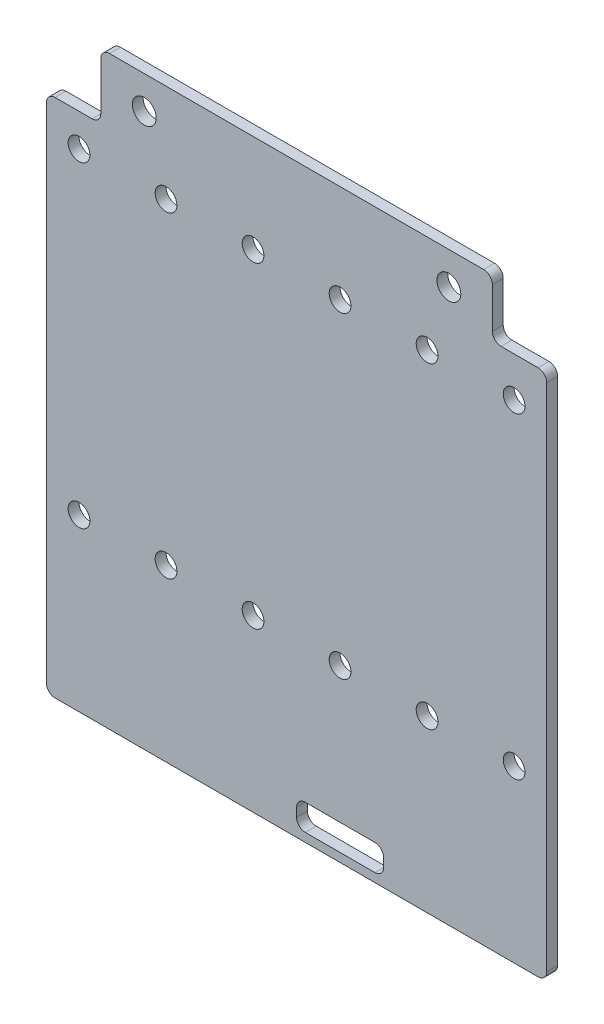
from build123d import *

# Parameters (mm, degrees)
SKETCH1_R           = 3.4925
SKETCH1_R_2         = 3.175
BOSS_EXTRUDE1_DEPTH = 3.175
FILLET2_R           = 2.54
FILLET3_R           = 2.54
SKETCH4_W           = 25.4
SKETCH4_H           = 7.62
CUT_EXTRUDE1_DEPTH  = 172.355687034
FILLET4_R           = 2.54


with BuildPart() as part:
    # Sketch1 → Boss-Extrude1 (new body)
    with BuildSketch(Plane.XY):
        Polygon((-57.15, -3.175), (-57.15, 15.875), (57.15, 15.875), (57.15, -1.009681966), (73.025, -1.009681966), (73.025, -27.559), (73.025, -154.983999912), (-73.025, -154.983999912), (-73.025, -27.559), (-73.025, -3.175), align=None)
        with Locations((-44.45, 6.35)):
            Circle(SKETCH1_R, mode=Mode.SUBTRACT)
        with Locations((44.45, 6.35)):
            Circle(SKETCH1_R, mode=Mode.SUBTRACT)
        with Locations((-63.5, -12.7)):
            Circle(SKETCH1_R_2, mode=Mode.SUBTRACT)
        with Locations((-38.1, -12.7)):
            Circle(SKETCH1_R_2, mode=Mode.SUBTRACT)
        with Locations((-12.7, -12.7)):
            Circle(SKETCH1_R_2, mode=Mode.SUBTRACT)
        with Locations((12.7, -12.7)):
            Circle(SKETCH1_R_2, mode=Mode.SUBTRACT)
        with Locations((38.1, -12.7)):
            Circle(SKETCH1_R_2, mode=Mode.SUBTRACT)
        with Locations((63.5, -12.7)):
            Circle(SKETCH1_R_2, mode=Mode.SUBTRACT)
        with Locations((-63.5, -105.199999912)):
            Circle(SKETCH1_R_2, mode=Mode.SUBTRACT)
        with Locations((-38.1, -105.199999912)):
            Circle(SKETCH1_R_2, mode=Mode.SUBTRACT)
        with Locations((-12.7, -105.199999912)):
            Circle(SKETCH1_R_2, mode=Mode.SUBTRACT)
        with Locations((12.7, -105.199999912)):
            Circle(SKETCH1_R_2, mode=Mode.SUBTRACT)
        with Locations((38.1, -105.199999912)):
            Circle(SKETCH1_R_2, mode=Mode.SUBTRACT)
        with Locations((63.5, -105.199999912)):
            Circle(SKETCH1_R_2, mode=Mode.SUBTRACT)
    extrude(amount=BOSS_EXTRUDE1_DEPTH)

    # Fillet2
    fillet2_edges = [part.edges().sort_by_distance(p)[0] for p in [
        (-73.025, -154.983999912, 1.5875),
        (-73.025, -3.175, 1.5875),
        (-57.15, 15.875, 1.5875),
        (57.15, 15.875, 1.5875),
        (73.025, -1.009681966, 1.5875),
        (73.025, -154.983999912, 1.5875),
    ]]
    fillet(fillet2_edges, radius=FILLET2_R)

    # Fillet3
    fillet3_edges = [part.edges().sort_by_distance(p)[0] for p in [
        (-57.15, -3.175, 1.5875),
        (57.15, -1.009681966, 1.5875),
    ]]
    fillet(fillet3_edges, radius=FILLET3_R)

    # Sketch4 → Cut-Extrude1 (cut, through all)
    with BuildSketch(Plane(origin=(0, 0, 0), x_dir=(-1, 0, 0), z_dir=(0, 0, -1))):
        with Locations((-12.7, -148.633999912)):
            Rectangle(SKETCH4_W, SKETCH4_H)
    extrude(amount=-CUT_EXTRUDE1_DEPTH, mode=Mode.SUBTRACT)

    # Fillet4
    fillet4_edges = [part.edges().sort_by_distance(p)[0] for p in [
        (0, -144.823999912, 1.5875),
        (0, -152.443999912, 1.5875),
        (25.4, -152.443999912, 1.5875),
        (25.4, -144.823999912, 1.5875),
    ]]
    fillet(fillet4_edges, radius=FILLET4_R)


solid = part.part
